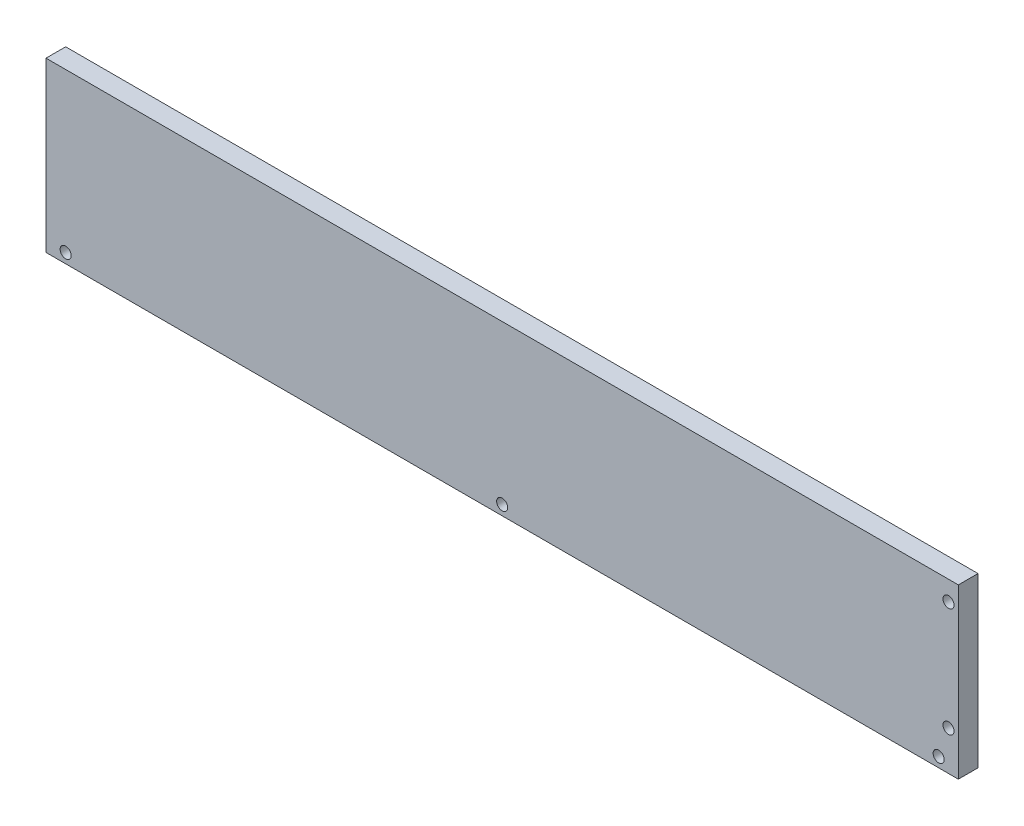
from build123d import *

# Parameters (mm, degrees)
SKETCH1_W           = 294.64
SKETCH1_H           = 54.35
SKETCH1_R           = 1.7859375
BOSS_EXTRUDE1_DEPTH = 6.35


with BuildPart() as part:
    # Sketch1 → Boss-Extrude1 (new body)
    with BuildSketch(Plane.XY):
        with Locations((-147.32, 27.175)):
            Rectangle(SKETCH1_W, SKETCH1_H)
        with Locations((-3.175, 48)):
            Circle(SKETCH1_R, mode=Mode.SUBTRACT)
        with Locations((-3.175, 12.7)):
            Circle(SKETCH1_R, mode=Mode.SUBTRACT)
        with Locations((-6.35, 3.175)):
            Circle(SKETCH1_R, mode=Mode.SUBTRACT)
        with Locations((-147.32, 3.175)):
            Circle(SKETCH1_R, mode=Mode.SUBTRACT)
        with Locations((-288.29, 3.175)):
            Circle(SKETCH1_R, mode=Mode.SUBTRACT)
    extrude(amount=BOSS_EXTRUDE1_DEPTH)


solid = part.part
